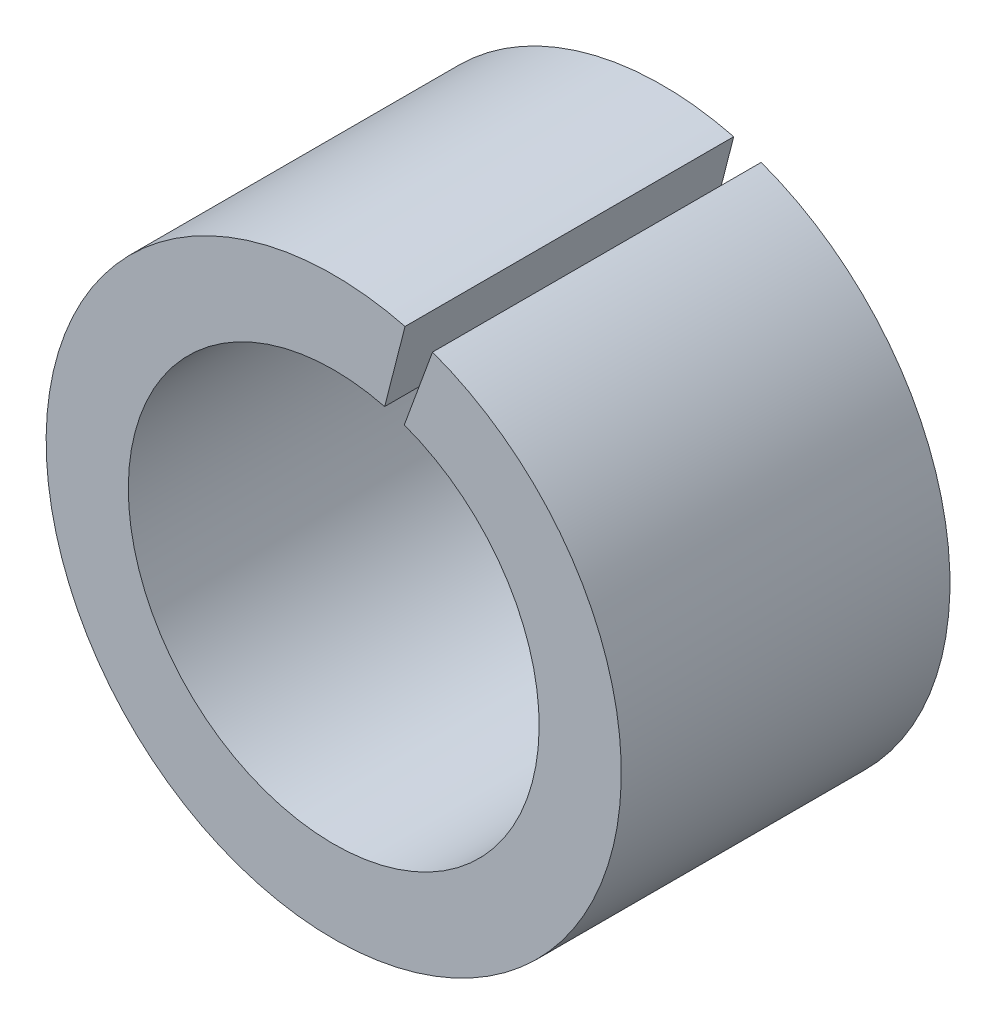
from build123d import *

# Parameters (mm, degrees)
SKETCH_1_R          = 3.5
SKETCH_1_R_2        = 2.5
EXTRUDE_1_DEPTH     = 4
CUT_EXTRUDE_1_DEPTH = 6


with BuildPart() as part:
    # 草图1 → 凸台-拉伸1 (new body)
    with BuildSketch(Plane.XY):
        Circle(SKETCH_1_R)
        Circle(SKETCH_1_R_2, mode=Mode.SUBTRACT)
    extrude(amount=EXTRUDE_1_DEPTH)

    # 草图2 → 切除-拉伸1 (cut)
    with BuildSketch(Plane.XY.offset(4)):
        Polygon((0, 0), (1.195643568, 4.670187004), (1.708170359, 4.670187004), align=None)
    extrude(amount=-CUT_EXTRUDE_1_DEPTH, mode=Mode.SUBTRACT)


solid = part.part
